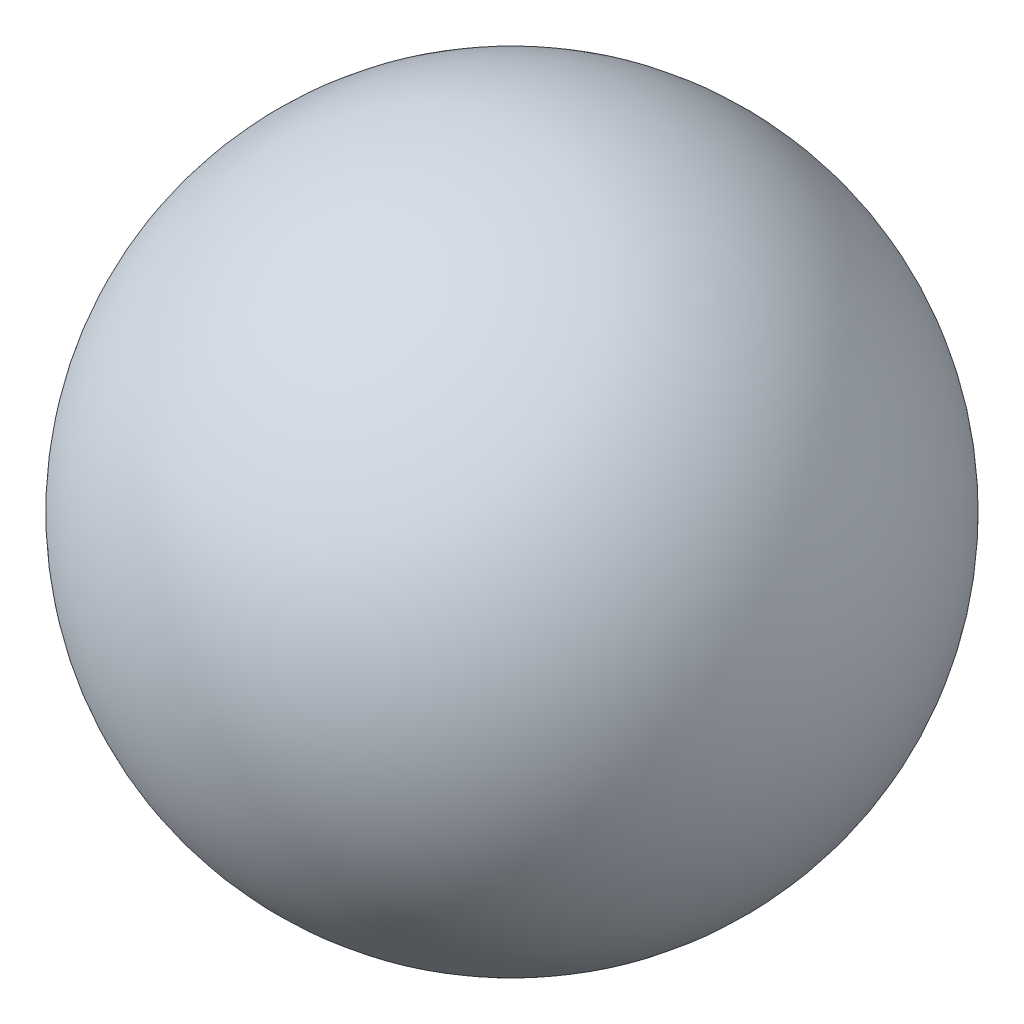
from build123d import *


with BuildPart() as part:
    # Sketch1 → Revolve1 (revolve)
    with BuildSketch(Plane.XY):
        with BuildLine():
            Line((0, 303), (0, 299))
            ThreePointArc((0, 299), (-299, 0), (0, -299))
            Line((0, -299), (0, -303))
            ThreePointArc((0, -303), (-303, 0), (0, 303))
        make_face()
    revolve(axis=Axis((0, -303, 0), (0, 1, 0)))


solid = part.part
